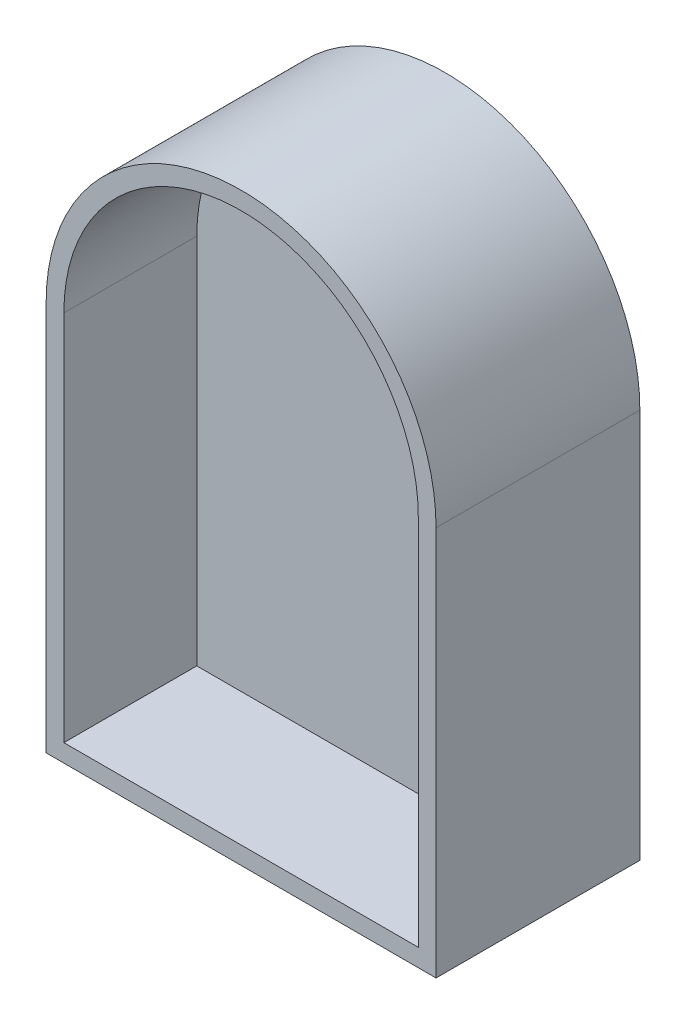
from build123d import *

# Parameters (mm, degrees)
BOSS_EXTRU_1_DEPTH      = 11.5
ENL_V_MAT_EXTRU_1_DEPTH = 7.5


with BuildPart() as part:
    # Esquisse1 → Boss.-Extru.1 (new body)
    with BuildSketch(Plane.XY):
        with BuildLine():
            Line((-11, 0), (11, 0))
            Line((11, 0), (11, 22))
            ThreePointArc((11, 22), (0, 33), (-11, 22))
            Line((-11, 22), (-11, 0))
        make_face()
    extrude(amount=BOSS_EXTRU_1_DEPTH)

    # Esquisse2 → Enlèv. mat.-Extru.1 (cut)
    with BuildSketch(Plane.XY.offset(11.5)):
        with BuildLine():
            Line((-10, 1), (-10, 22))
            ThreePointArc((-10, 22), (0, 32), (10, 22))
            Line((10, 22), (10, 1))
            Line((10, 1), (-10, 1))
        make_face()
    extrude(amount=-ENL_V_MAT_EXTRU_1_DEPTH, mode=Mode.SUBTRACT)


solid = part.part
